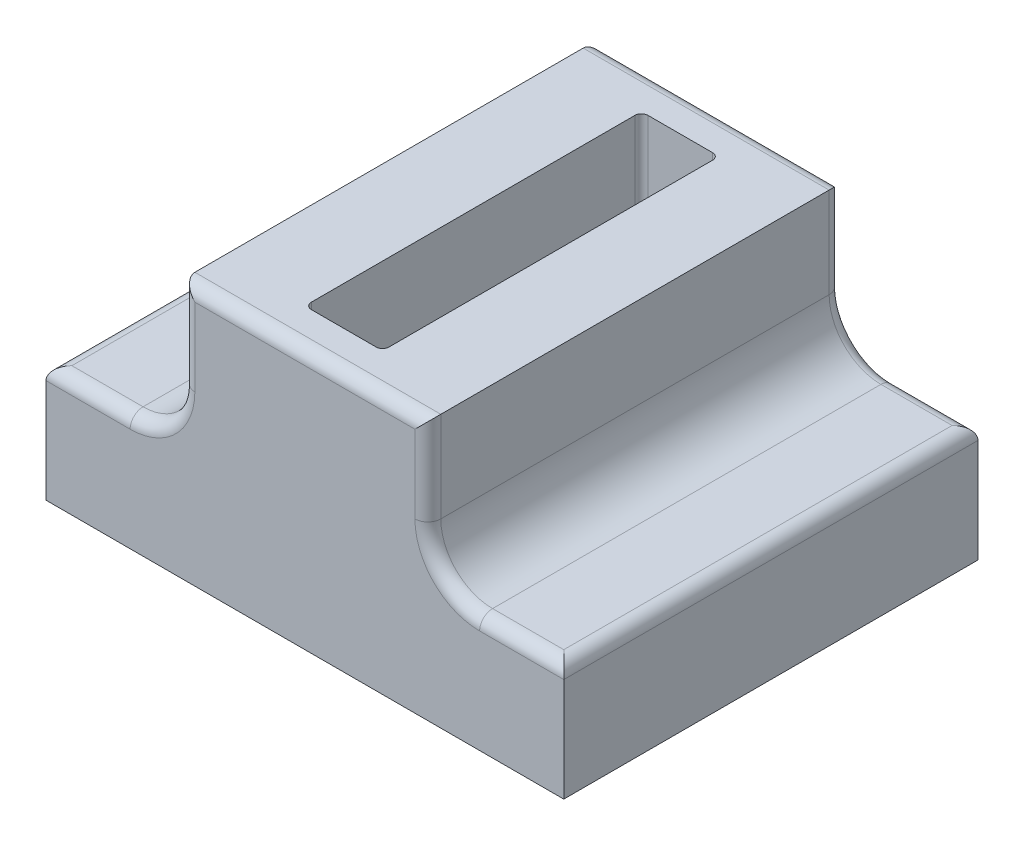
from build123d import *

# Parameters (mm, degrees)
SKETCH1_W           = 20
SKETCH1_H           = 16
SKETCH1_W_2         = 3
SKETCH1_H_2         = 13
BOSS_EXTRUDE1_DEPTH = 4.5
SKETCH2_W           = 9.5
SKETCH2_H           = 16
SKETCH2_W_2         = 3
SKETCH2_H_2         = 13
BOSS_EXTRUDE2_DEPTH = 5.5
FILLET1_R           = 2
FILLET2_R           = 0.5
FILLET3_R           = 0.25


with BuildPart() as part:
    # Sketch1 → Boss-Extrude1 (new body)
    with BuildSketch(Plane(origin=(0, 0, 0), x_dir=(1, 0, 0), z_dir=(0, 1, 0))):
        with Locations((10, -8)):
            Rectangle(SKETCH1_W, SKETCH1_H)
        with Locations((10, -8)):
            Rectangle(SKETCH1_W_2, SKETCH1_H_2, mode=Mode.SUBTRACT)
    extrude(amount=BOSS_EXTRUDE1_DEPTH)

    # Sketch2 → Boss-Extrude2 (add)
    with BuildSketch(Plane(origin=(0, 4.5, 0), x_dir=(1, 0, 0), z_dir=(0, 1, 0))):
        with Locations((10, -8)):
            Rectangle(SKETCH2_W, SKETCH2_H)
        with Locations((10, -8)):
            Rectangle(SKETCH2_W_2, SKETCH2_H_2, mode=Mode.SUBTRACT)
    extrude(amount=BOSS_EXTRUDE2_DEPTH)

    # Fillet1
    fillet1_edges = [part.edges().sort_by_distance(p)[0] for p in [
        (5.25, 4.5, 8),
        (14.75, 4.5, 8),
    ]]
    fillet(fillet1_edges, radius=FILLET1_R)

    # Fillet2
    fillet2_edges = [part.edges().sort_by_distance(p)[0] for p in [
        (20, 4.5, 8),
        (18.375, 4.5, 0),
        (10, 10, 16),
        (10, 10, 0),
        (5.25, 8.25, 0),
        (5.25, 8.25, 16),
        (14.75, 8.25, 16),
        (14.75, 8.25, 0),
        (0, 4.5, 8),
        (1.625, 4.5, 0),
        (18.375, 4.5, 16),
        (4.664213562, 5.085786438, 16),
        (4.664213562, 5.085786438, 0),
        (15.335786438, 5.085786438, 0),
        (15.335786438, 5.085786438, 16),
        (1.625, 4.5, 16),
    ]]
    fillet(fillet2_edges, radius=FILLET2_R)

    # Fillet3
    fillet3_edges = [part.edges().sort_by_distance(p)[0] for p in [
        (8.5, 5, 1.5),
        (8.5, 5, 14.5),
        (11.5, 5, 14.5),
        (11.5, 5, 1.5),
    ]]
    fillet(fillet3_edges, radius=FILLET3_R)


solid = part.part
